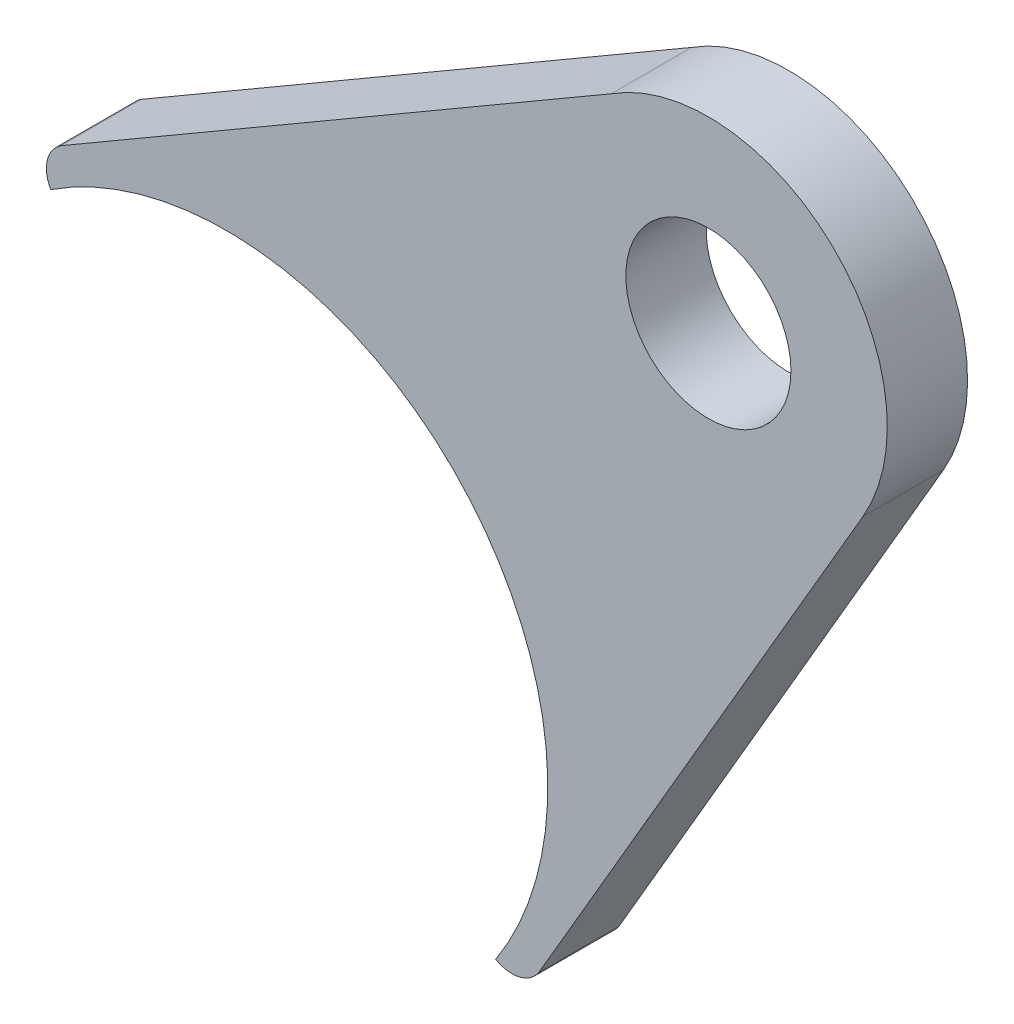
from build123d import *

# Parameters (mm, degrees)
SKETCH1_R           = 3.2639
BOSS_EXTRUDE1_DEPTH = 3.175


with BuildPart() as part:
    # Sketch1 → Boss-Extrude1 (new body)
    with BuildSketch(Plane.XY):
        with BuildLine():
            Line((-6.54906316, 12.333299322), (15.202863294, 24.986295173))
            ThreePointArc((15.202863294, 24.986295173), (23.930769686, 24.17036605), (25.163710326, 15.491544259))
            Line((25.163710326, 15.491544259), (12.348893474, -6.525331544))
            ThreePointArc((12.348893474, -6.525331544), (11.576601959, -7.071951545), (10.640708411, -6.932916018))
            ThreePointArc((10.640708411, -6.932916018), (8.971050146, 8.989452668), (-6.954706605, 10.626479005))
            ThreePointArc((-6.954706605, 10.626479005), (-7.093959218, 11.561186656), (-6.54906316, 12.333299322))
        make_face()
        with Locations((19.05, 19.05)):
            Circle(SKETCH1_R, mode=Mode.SUBTRACT)
    extrude(amount=BOSS_EXTRUDE1_DEPTH)


solid = part.part
